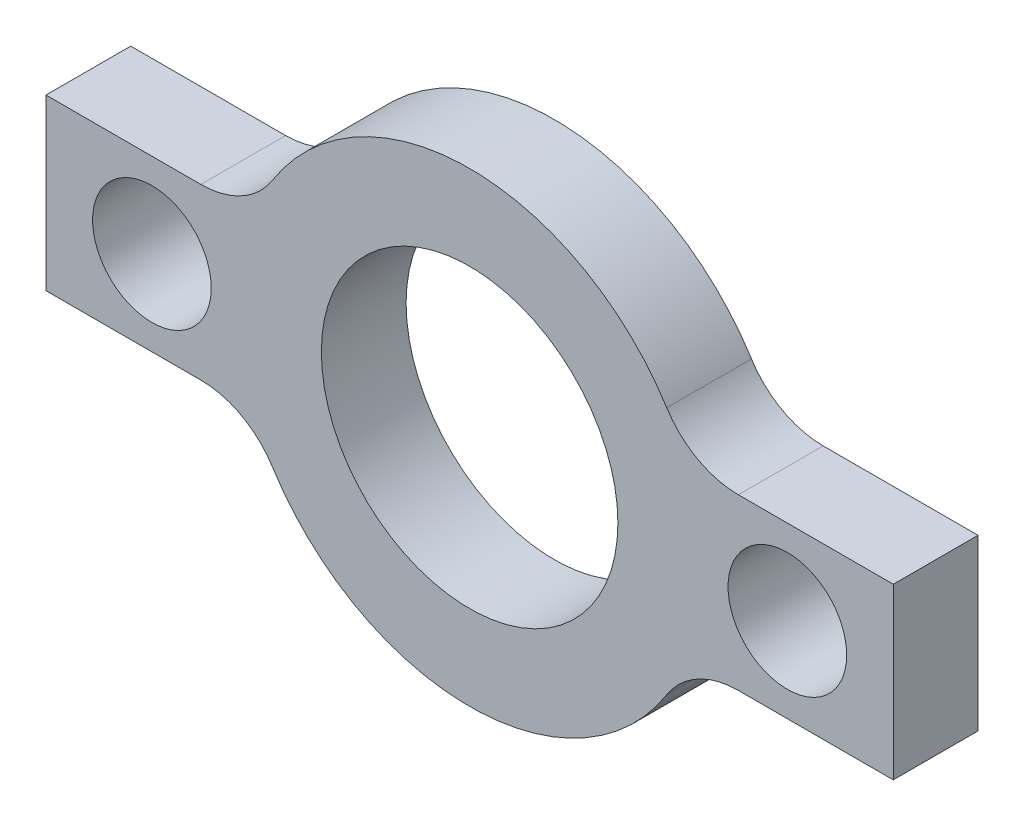
from build123d import *

# Parameters (mm, degrees)
SKETCH_1_R      = 3.5
SKETCH_1_R_2    = 1.4
EXTRUDE_1_DEPTH = 2


with BuildPart() as part:
    # 草图1 → 凸台-拉伸1 (new body)
    with BuildSketch(Plane.XY):
        with BuildLine():
            Line((-10, -2), (-6.34428877, -2))
            ThreePointArc((-6.34428877, -2), (-5.378196987, -2.248809928), (-4.652478431, -2.933333333))
            ThreePointArc((-4.652478431, -2.933333333), (0, -5.5), (4.652478431, -2.933333333))
            ThreePointArc((4.652478431, -2.933333333), (5.378196987, -2.248809928), (6.34428877, -2))
            Line((6.34428877, -2), (10, -2))
            Line((10, -2), (10, 2))
            Line((10, 2), (6.34428877, 2))
            ThreePointArc((6.34428877, 2), (5.378196987, 2.248809928), (4.652478431, 2.933333333))
            ThreePointArc((4.652478431, 2.933333333), (0, 5.5), (-4.652478431, 2.933333333))
            ThreePointArc((-4.652478431, 2.933333333), (-5.378196987, 2.248809928), (-6.34428877, 2))
            Line((-6.34428877, 2), (-10, 2))
            Line((-10, 2), (-10, -2))
        make_face()
        Circle(SKETCH_1_R, mode=Mode.SUBTRACT)
        with Locations((-7.5, 0)):
            Circle(SKETCH_1_R_2, mode=Mode.SUBTRACT)
        with Locations((7.5, 0)):
            Circle(SKETCH_1_R_2, mode=Mode.SUBTRACT)
    extrude(amount=EXTRUDE_1_DEPTH)


solid = part.part
